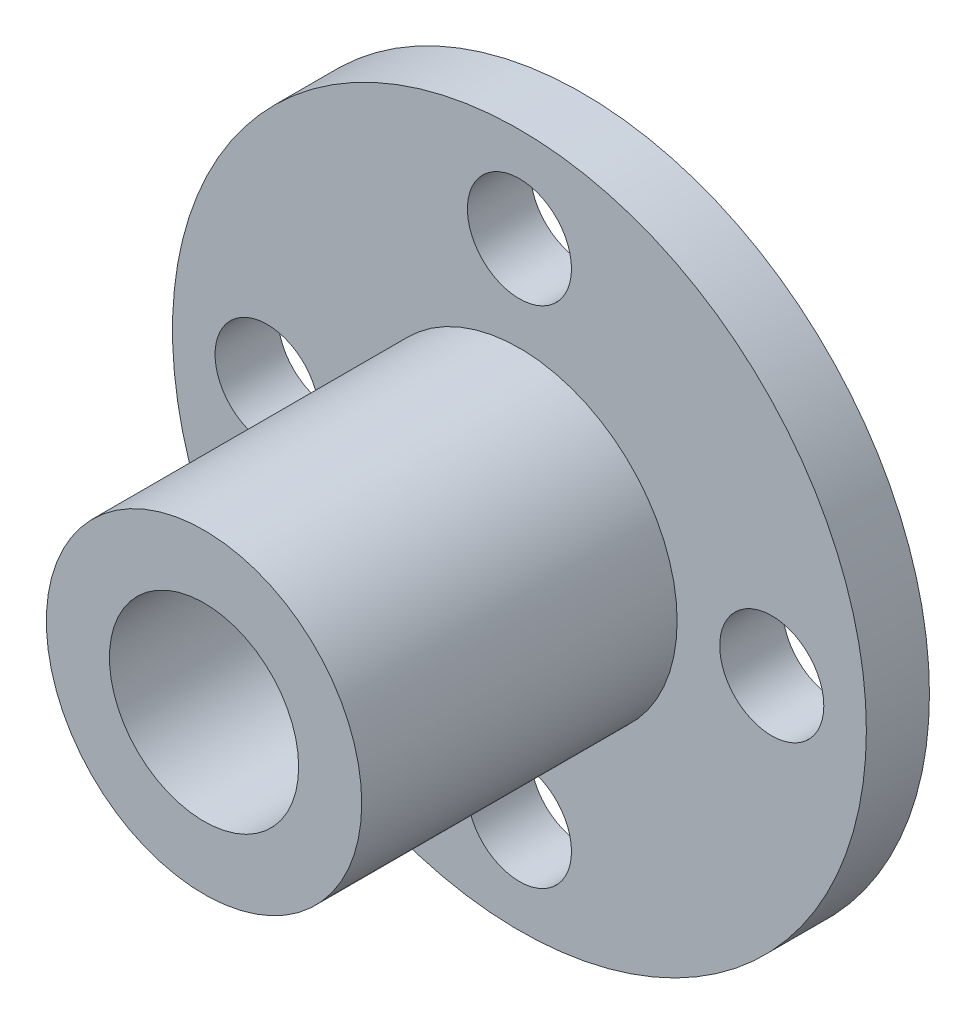
from build123d import *

# Parameters (mm, degrees)
SKETCH_1_R      = 11
SKETCH_1_R_2    = 3
SKETCH_1_R_3    = 1.65
EXTRUDE_1_DEPTH = 2
SKETCH_2_R      = 5
SKETCH_2_R_2    = 3
EXTRUDE_2_DEPTH = 10


with BuildPart() as part:
    # 草图1 → 凸台-拉伸1 (new body)
    with BuildSketch(Plane.XY):
        Circle(SKETCH_1_R)
        Circle(SKETCH_1_R_2, mode=Mode.SUBTRACT)
        with Locations((0, 8)):
            Circle(SKETCH_1_R_3, mode=Mode.SUBTRACT)
        with Locations((8, 0)):
            Circle(SKETCH_1_R_3, mode=Mode.SUBTRACT)
        with Locations((0, -8)):
            Circle(SKETCH_1_R_3, mode=Mode.SUBTRACT)
        with Locations((-8, 0)):
            Circle(SKETCH_1_R_3, mode=Mode.SUBTRACT)
    extrude(amount=EXTRUDE_1_DEPTH)

    # 草图2 → 凸台-拉伸2 (add)
    with BuildSketch(Plane.XY.offset(2)):
        Circle(SKETCH_2_R)
        Circle(SKETCH_2_R_2, mode=Mode.SUBTRACT)
    extrude(amount=EXTRUDE_2_DEPTH)


solid = part.part
